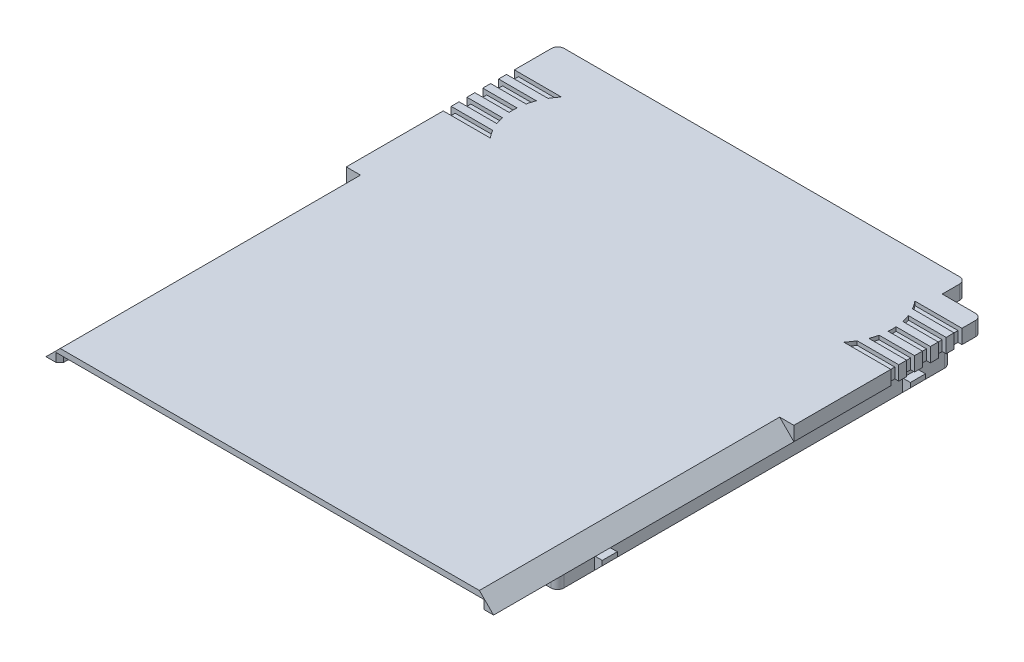
from build123d import *

# Parameters (mm, degrees)
BOSS_EXTRUDE1_DEPTH  = 5.2
CUT_EXTRUDE9_DEPTH   = 3.4
SKETCH13_W           = 53.15
SKETCH13_H           = 10
CUT_EXTRUDE10_DEPTH  = 0.6
BOSS_EXTRUDE4_START  = -7.2
BOSS_EXTRUDE4_DEPTH  = 1.9
LPATTERN3_COUNT      = 2
LPATTERN3_PITCH      = 39
MIRROR4_START        = -7.2
MIRROR4_COPY_1_DEPTH = 1.9
SKETCH15_R           = 2
SKETCH15_R_2         = 0.75
BOSS_EXTRUDE5_DEPTH  = 2.4
SKETCH3_W            = 0.5
SKETCH3_H            = 1
CUT_EXTRUDE2_DEPTH   = 5.6
LPATTERN1_COUNT      = 5
LPATTERN1_PITCH      = 2
CUT_EXTRUDE15_DEPTH  = 38
CUT_EXTRUDE16_DEPTH  = 0.5
CHAMFER1_SIZE        = 0.5
FILLET1_R            = 0.8
BOSS_EXTRUDE6_START  = -21
BOSS_EXTRUDE6_DEPTH  = 1.9
CUT_EXTRUDE17_START  = -1
SKETCH29_R           = 0.75
CUT_EXTRUDE17_DEPTH  = 1


with BuildPart() as part:
    # Sketch1 → Boss-Extrude1 (new body)
    with BuildSketch(Plane(origin=(0, 0, 0), x_dir=(1, 0, 0), z_dir=(0, 1, 0))):
        Polygon((23.321, 32.385), (-28.321, 32.385), (-28.321, -32.385), (28.321, -32.385), (28.321, 29.385), (23.321, 29.385), align=None)
    extrude(amount=BOSS_EXTRUDE1_DEPTH)

    # Sketch12 → Cut-Extrude9 (cut)
    # profile 1 of 2: a face of its own
    with BuildSketch(Plane.XZ):
        Polygon((28.321, 32.385), (-28.321, 32.385), (-28.321, -32.385), (23.321, -32.385), (23.321, -29.385), (28.321, -29.385), align=None)
        Polygon((-26.4, -30.385), (-26.4, 22.385), (26.4, 22.385), (26.4, -27.415), (21.321, -27.415), (21.321, -30.385), align=None, mode=Mode.SUBTRACT)
    # profile 2 of 2: a face of its own
    with BuildSketch(Plane.XZ):
        Polygon((-25, 20.985), (-25, -28.985), (19.921, -28.985), (19.921, -26.015), (25, -26.015), (25, 20.985), align=None)
    extrude(amount=-CUT_EXTRUDE9_DEPTH, mode=Mode.SUBTRACT)

    # Sketch13 → Cut-Extrude10 (cut)
    with BuildSketch(Plane.XZ.offset(-3.4)):
        with Locations((0, 27.385)):
            Rectangle(SKETCH13_W, SKETCH13_H)
    extrude(amount=-CUT_EXTRUDE10_DEPTH, mode=Mode.SUBTRACT)


with BuildPart() as body_2:
    # Sketch14 → Boss-Extrude4 (new body)
    with BuildSketch(Plane(origin=(0, 0, -30.385), x_dir=(-1, 0, 0), z_dir=(0, 0, -1)).offset(BOSS_EXTRUDE4_START)):
        Polygon((26.4, 1.6), (27.4, 1.6), (27.4, 1), (26.4, 0), align=None)
    boss_extrude4 = extrude(amount=-BOSS_EXTRUDE4_DEPTH)


with BuildPart() as lpattern3_1:
    # LPattern3: Boss-Extrude4 ×2
    with Locations(*[(0, 0, i * LPATTERN3_PITCH) for i in range(1, LPATTERN3_COUNT)]):
        add(boss_extrude4)


with BuildPart() as part_1:
    add(part.part)

    # Mirror4: Boss-Extrude4 across plane
    add(boss_extrude4.mirror(Plane(origin=(0, 0, 0), x_dir=(0, 0, 1), z_dir=(1, 0, 0))))

    # Mirror4 copy 1 sketch → Mirror4 copy 1 (add)
    with BuildSketch(Plane(origin=(0, 0, 8.615), x_dir=(1, 0, 0), z_dir=(0, 0, -1)).offset(MIRROR4_START)):
        Polygon((26.4, -1.6), (27.4, -1.6), (27.4, -1), (26.4, 0), align=None)
    extrude(amount=-MIRROR4_COPY_1_DEPTH)

    # Sketch15 → Boss-Extrude5 (add)
    with BuildSketch(Plane.XZ.offset(-3.4)):
        with Locations(Location((0, 15.535, 0), (0, 0, 270))):
            Circle(SKETCH15_R)
        with Locations(Location((0, 15.535, 0), (0, 0, 270))):
            Circle(SKETCH15_R_2, mode=Mode.SUBTRACT)
    extrude(amount=BOSS_EXTRUDE5_DEPTH)

    # Sketch3 → Cut-Extrude2 (cut)
    with BuildSketch(Plane.XZ):
        with Locations((-28.071, -26.385)):
            Rectangle(SKETCH3_W, SKETCH3_H)
        with Locations((28.071, -26.385)):
            Rectangle(SKETCH3_W, SKETCH3_H)
    cut_extrude2 = extrude(amount=-CUT_EXTRUDE2_DEPTH, mode=Mode.SUBTRACT)

    # LPattern1: Cut-Extrude2 ×5
    with Locations(*[(0, 0, i * LPATTERN1_PITCH) for i in range(1, LPATTERN1_COUNT)]):
        add(cut_extrude2, mode=Mode.SUBTRACT)

    # Sketch20 → Cut-Extrude15 (cut)
    with BuildSketch(Plane.XY.offset(32.385)):
        Polygon((-26.521, 5.2), (-28.321, 3.4), (-28.321, 5.2), align=None)
    cut_extrude15 = extrude(amount=-CUT_EXTRUDE15_DEPTH, mode=Mode.SUBTRACT)

    # Mirror6: Cut-Extrude15 across plane
    add(cut_extrude15.mirror(Plane(origin=(0, 0, 0), x_dir=(0, 0, 1), z_dir=(1, 0, 0))), mode=Mode.SUBTRACT)

    # Sketch21 → Cut-Extrude16 (cut)
    with BuildSketch(Plane(origin=(0, 5.2, 0), x_dir=(1, 0, 0), z_dir=(0, 1, 0))):
        with BuildLine():
            Line((-22.361901529, 17.885), (-28.321, 17.885))
            Line((-28.321, 17.885), (-28.321, 18.885))
            Line((-28.321, 18.885), (-23.062176709, 18.885))
            ThreePointArc((-23.062176709, 18.885), (-22.733880959, 18.369704702), (-22.361901529, 17.885))
        make_face()
        with BuildLine():
            Line((-23.538347297, 19.885), (-28.321, 19.885))
            Line((-28.321, 19.885), (-28.321, 20.885))
            Line((-28.321, 20.885), (-23.837396048, 20.885))
            ThreePointArc((-23.837396048, 20.885), (-23.706536175, 20.379418404), (-23.538347297, 19.885))
        make_face()
        with BuildLine():
            Line((-23.982118904, 21.885), (-28.321, 21.885))
            Line((-28.321, 21.885), (-28.321, 22.885))
            Line((-28.321, 22.885), (-23.982118904, 22.885))
            ThreePointArc((-23.982118904, 22.885), (-23.999998882, 22.385), (-23.982118904, 21.885))
        make_face()
        with BuildLine():
            Line((-23.837396048, 23.885), (-28.321, 23.885))
            Line((-28.321, 23.885), (-28.321, 24.885))
            Line((-28.321, 24.885), (-23.538347297, 24.885))
            ThreePointArc((-23.538347297, 24.885), (-23.706536175, 24.390581596), (-23.837396048, 23.885))
        make_face()
        with BuildLine():
            Line((-23.062176709, 25.885), (-28.321, 25.885))
            Line((-28.321, 25.885), (-28.321, 26.885))
            Line((-28.321, 26.885), (-22.361901529, 26.885))
            ThreePointArc((-22.361901529, 26.885), (-22.733880959, 26.400295298), (-23.062176709, 25.885))
        make_face()
    cut_extrude16 = extrude(amount=-CUT_EXTRUDE16_DEPTH, mode=Mode.SUBTRACT)

    # Mirror7: Cut-Extrude16 across plane
    add(cut_extrude16.mirror(Plane(origin=(0, 0, 0), x_dir=(0, 0, 1), z_dir=(1, 0, 0))), mode=Mode.SUBTRACT)

    # Chamfer1
    chamfer1_edges = [part_1.edges().sort_by_distance(p)[0] for p in [
        (0, 4, 32.385),
        (-26.575, 3.7, 32.385),
        (26.575, 3.7, 32.385),
    ]]
    chamfer(chamfer1_edges, length=CHAMFER1_SIZE)

    # Fillet1
    fillet1_edges = [part_1.edges().sort_by_distance(p)[0] for p in [
        (-28.321, 4.3, -32.385),
        (23.321, 4.3, -32.385),
        (28.321, 4.3, -29.385),
        (-26.4, 1.7, 22.385),
        (-26.4, 1.7, -30.385),
        (21.321, 1.7, -30.385),
        (26.4, 1.7, -27.415),
        (26.4, 1.7, 22.385),
        (19.921, 1.7, -26.015),
    ]]
    fillet(fillet1_edges, radius=FILLET1_R)

    # Sketch28 → Boss-Extrude6 (add)
    with BuildSketch(Plane(origin=(21.321, 0, 0), x_dir=(0, 0, -1), z_dir=(1, 0, 0)).offset(BOSS_EXTRUDE6_START)):
        Polygon((30.385, 1.6), (31.385, 1.6), (31.385, 1), (30.385, 0), align=None)
    extrude(amount=-BOSS_EXTRUDE6_DEPTH)

    # Sketch29 → Cut-Extrude17 (cut)
    with BuildSketch(Plane.XZ.offset(-3.4).offset(CUT_EXTRUDE17_START)):
        with Locations(Location((0, 15.535, 0), (0, 0, 270))):
            Circle(SKETCH29_R)
    extrude(amount=CUT_EXTRUDE17_DEPTH, mode=Mode.SUBTRACT)


solid = Compound([body_2.part, lpattern3_1.part, part_1.part])
